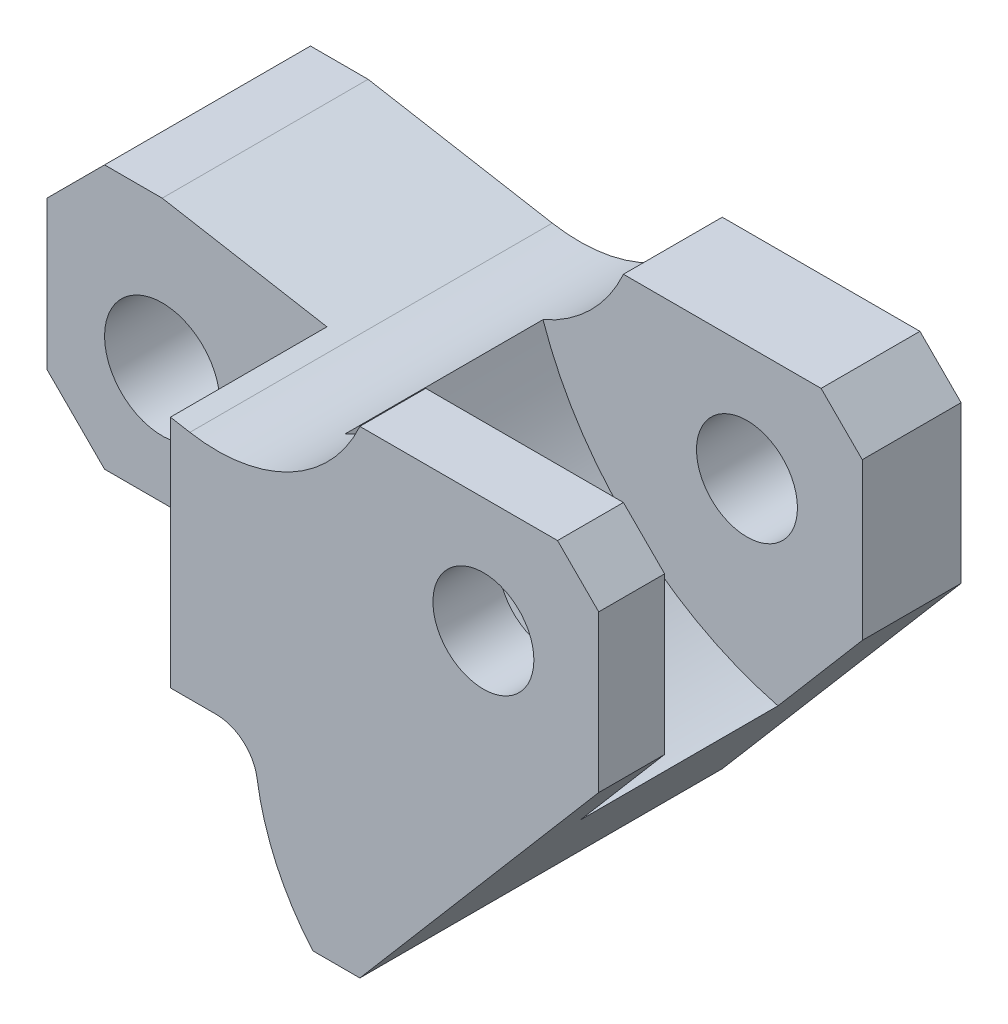
from build123d import *

# Parameters (mm, degrees)
BOSS_EXTRUDE1_DEPTH = 44
SKETCH5_R           = 7
CUT_EXTRUDE1_DEPTH  = 171.828393793
CHAMFER1_SIZE       = 7
CHAMFER2_SIZE       = 7
CHAMFER3_SIZE       = 5
SKETCH8_R           = 6.128605104
CUT_EXTRUDE2_DEPTH  = 171.828393793
SKETCH9_W           = 34
SKETCH9_H           = 19
CUT_EXTRUDE3_DEPTH  = 168.605610181
CUT_EXTRUDE4_START  = -12
CUT_EXTRUDE4_DEPTH  = 24


with BuildPart() as part:
    # Sketch4 → Boss-Extrude1 (new body)
    with BuildSketch(Plane.XY):
        with BuildLine():
            Line((-153.475211562, 21.759357812), (-153.475211562, 53.759357812))
            Line((-153.475211562, 53.759357812), (-139.475211562, 53.759357812))
            Line((-139.475211562, 53.759357812), (-117.113830726, 49.816443045))
            ThreePointArc((-117.113830726, 49.816443045), (-104.914112856, 51.741401954), (-96.475211562, 60.759357812))
            Line((-96.475211562, 60.759357812), (-67.475211562, 60.759357812))
            Line((-67.475211562, 60.759357812), (-67.475211562, 36.759357812))
            Line((-67.475211562, 36.759357812), (-96.475211562, 2.759357812))
            Line((-96.475211562, 2.759357812), (-102.178231509, 2.759357812))
            ThreePointArc((-102.178231509, 2.759357812), (-106.617203706, 9.643685751), (-108.954033909, 17.49465193))
            ThreePointArc((-108.954033909, 17.49465193), (-110.63443687, 20.545944044), (-113.899672651, 21.759357812))
            Line((-113.899672651, 21.759357812), (-153.475211562, 21.759357812))
        make_face()
    extrude(amount=BOSS_EXTRUDE1_DEPTH)

    # Sketch5 → Cut-Extrude1 (cut, through all)
    with BuildSketch(Plane.XY):
        with Locations((-139.475211562, 35.759357812)):
            Circle(SKETCH5_R)
    extrude(amount=CUT_EXTRUDE1_DEPTH, mode=Mode.SUBTRACT)

    # Chamfer1
    chamfer1_edges = [part.edges().sort_by_distance(p)[0] for p in [
        (-153.475211562, 53.759357812, 22),
    ]]
    chamfer(chamfer1_edges, length=CHAMFER1_SIZE)

    # Chamfer2
    chamfer2_edges = [part.edges().sort_by_distance(p)[0] for p in [
        (-153.475211562, 21.759357812, 22),
    ]]
    chamfer(chamfer2_edges, length=CHAMFER2_SIZE)

    # Chamfer3
    chamfer3_edges = [part.edges().sort_by_distance(p)[0] for p in [
        (-67.475211562, 60.759357812, 22),
    ]]
    chamfer(chamfer3_edges, length=CHAMFER3_SIZE)

    # Sketch8 → Cut-Extrude2 (cut, through all)
    with BuildSketch(Plane.XY.offset(44)):
        with Locations((-81.475211562, 46.759357812)):
            Circle(SKETCH8_R)
    extrude(amount=-CUT_EXTRUDE2_DEPTH, mode=Mode.SUBTRACT)

    # Sketch9 → Cut-Extrude3 (cut, through all)
    with BuildSketch(Plane(origin=(0, 53.759357812, 0), x_dir=(1, 0, 0), z_dir=(0, 1, 0))):
        with Locations((-136.475211562, -34.5)):
            Rectangle(SKETCH9_W, SKETCH9_H)
    extrude(amount=-CUT_EXTRUDE3_DEPTH, mode=Mode.SUBTRACT)

    # Sketch10 → Cut-Extrude4 (cut)
    with BuildSketch(Plane(origin=(0, 0, 0), x_dir=(-1, 0, 0), z_dir=(0, 0, -1)).offset(CUT_EXTRUDE4_START)):
        with BuildLine():
            Line((77.71050568, 24.759357812), (67.475211562, 36.759357812))
            Line((67.475211562, 36.759357812), (67.475211562, 55.759357812))
            Line((67.475211562, 55.759357812), (72.475211562, 60.759357812))
            Line((72.475211562, 60.759357812), (96.475211562, 60.759357812))
            ThreePointArc((96.475211562, 60.759357812), (100.453967219, 55.018691433), (106.238275013, 51.103652429))
            ThreePointArc((106.238275013, 51.103652429), (95.290948579, 34.340063041), (77.71050568, 24.759357812))
        make_face()
    extrude(amount=-CUT_EXTRUDE4_DEPTH, mode=Mode.SUBTRACT)


solid = part.part
